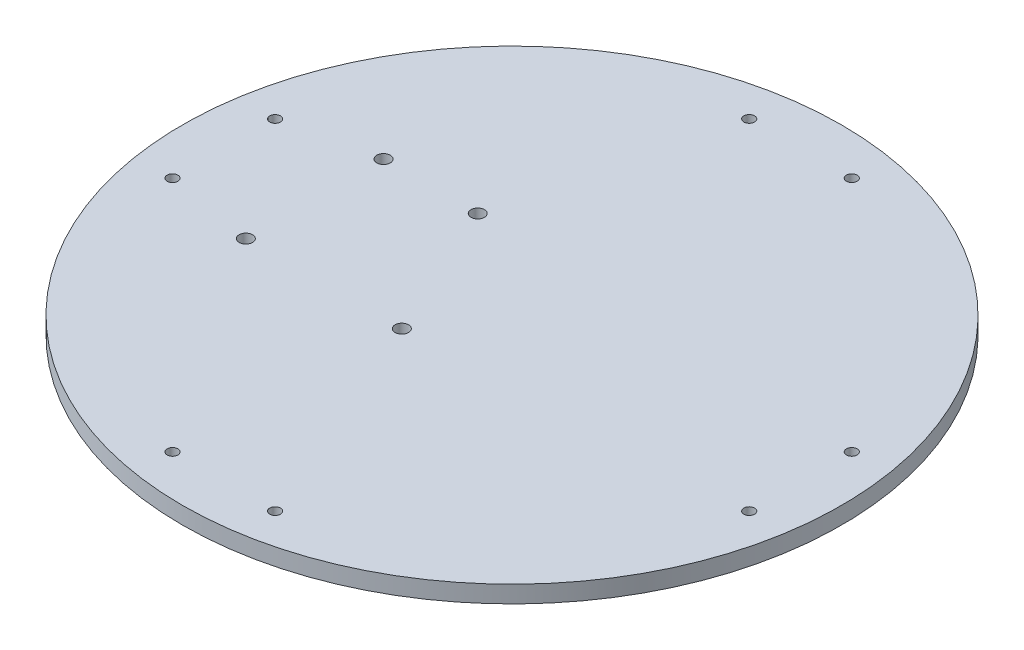
from build123d import *

# Parameters (mm, degrees)
SKETCH1_R           = 122.4
BOSS_EXTRUDE1_DEPTH = 6.35
SKETCH2_R           = 1.9939
CUT_EXTRUDE1_DEPTH  = 174.216172744
CIRPATTERN1_COUNT   = 4
SKETCH3_R           = 2.5
CUT_EXTRUDE3_DEPTH  = 174.216172744


with BuildPart() as part:
    # Sketch1 → Boss-Extrude1 (new body)
    with BuildSketch(Plane(origin=(0, 0, 0), x_dir=(1, 0, 0), z_dir=(0, 1, 0))):
        with Locations(Location((0, 0, 0), (0, 0, 270))):
            Circle(SKETCH1_R)
    extrude(amount=BOSS_EXTRUDE1_DEPTH)

    # Sketch2 → Cut-Extrude1 (cut, through all)
    with BuildSketch(Plane(origin=(0, 6.35, 0), x_dir=(1, 0, 0), z_dir=(0, 1, 0))):
        with Locations(Location((-19.05, -107.035541925, 0), (0, 0, 270))):
            Circle(SKETCH2_R)
        with Locations(Location((19.05, -107.035541925, 0), (0, 0, 270))):
            Circle(SKETCH2_R)
    cut_extrude1 = extrude(amount=-CUT_EXTRUDE1_DEPTH, mode=Mode.SUBTRACT)

    # CirPattern1: Cut-Extrude1 ×4 about axis
    cirpattern1_axis = Axis((0, 0, -0.056837174), (0, 1, 0))
    for i in range(1, CIRPATTERN1_COUNT):
        add(cut_extrude1.rotate(cirpattern1_axis, i * 360 / CIRPATTERN1_COUNT), mode=Mode.SUBTRACT)

    # Sketch3 → Cut-Extrude3 (cut, through all)
    with BuildSketch(Plane(origin=(0, 6.35, 0), x_dir=(1, 0, 0), z_dir=(0, 1, 0))):
        with Locations(Location((-74.054631747, 26.335816411, 0), (0, 0, 270))):
            Circle(SKETCH3_R)
        with Locations(Location((-39.054631747, 26.335816411, 0), (0, 0, 270))):
            Circle(SKETCH3_R)
        with Locations(Location((-16.113436886, -24.808749019, 0), (0, 0, 270))):
            Circle(SKETCH3_R)
        with Locations(Location((-74.054631747, -24.808749019, 0), (0, 0, 270))):
            Circle(SKETCH3_R)
    extrude(amount=-CUT_EXTRUDE3_DEPTH, mode=Mode.SUBTRACT)


solid = part.part
